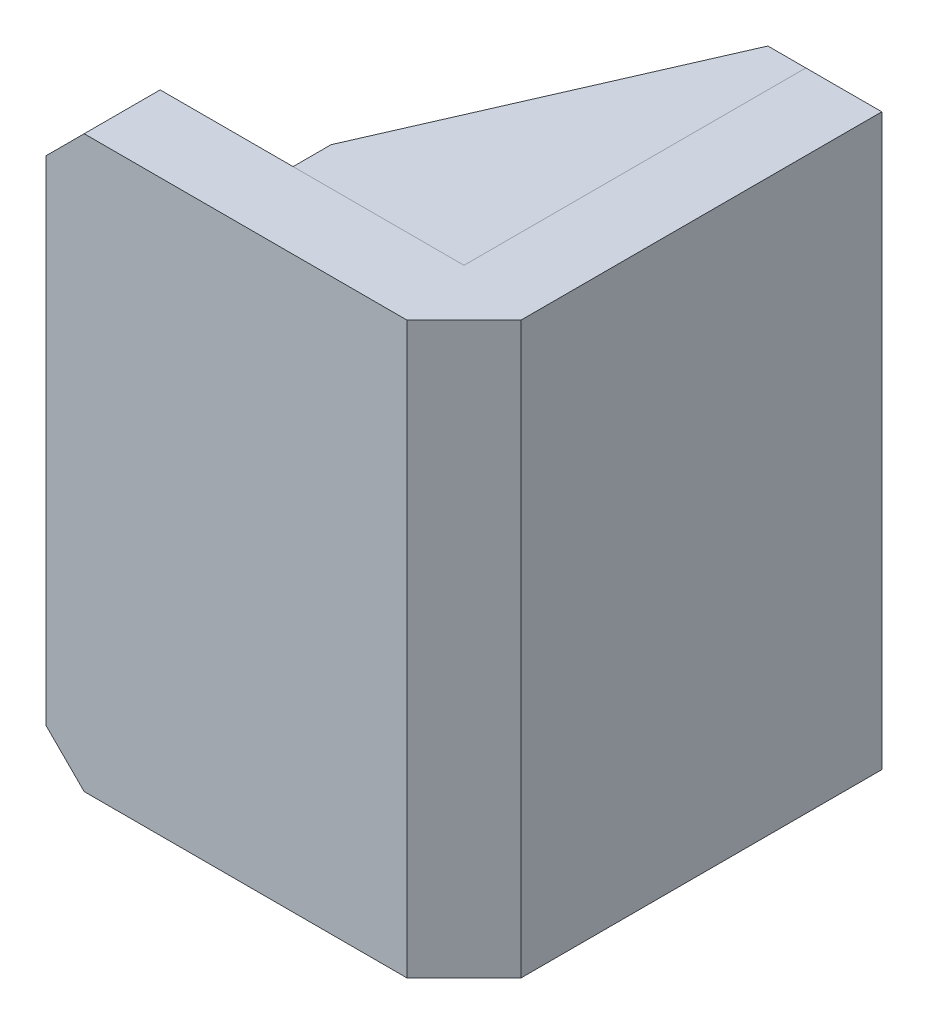
from build123d import *

# Parameters (mm, degrees)
SKETCH_1_W      = 90
SKETCH_1_H      = 150
EXTRUDE_1_DEPTH = 20
SKETCH_2_W      = 110
SKETCH_2_H      = 150
EXTRUDE_2_DEPTH = 20
CHAMFER_1_SIZE  = 10
EXTRUDE_3_DEPTH = 15
CHAMFER_2_SIZE  = 15


with BuildPart() as part:
    # 草图1 → 凸台-拉伸1 (new body)
    with BuildSketch(Plane.XY):
        Rectangle(SKETCH_1_W, SKETCH_1_H)
    extrude(amount=EXTRUDE_1_DEPTH)

    # 草图2 → 凸台-拉伸2 (add)
    with BuildSketch(Plane(origin=(45, 0, 0), x_dir=(0, 0, -1), z_dir=(1, 0, 0))):
        with Locations((35, 0)):
            Rectangle(SKETCH_2_W, SKETCH_2_H)
    extrude(amount=EXTRUDE_2_DEPTH)

    # 倒角1
    chamfer_1_edges = [part.edges().sort_by_distance(p)[0] for p in [
        (-45, -75, 10),
        (-45, 75, 10),
    ]]
    chamfer(chamfer_1_edges, length=CHAMFER_1_SIZE)

    # 倒角2
    chamfer_2_edges = [part.edges().sort_by_distance(p)[0] for p in [
        (65, 0, 20),
    ]]
    chamfer(chamfer_2_edges, length=CHAMFER_2_SIZE)


with BuildPart() as body_2:
    # 草图3 → 凸台-拉伸3 (new body)
    with BuildSketch(Plane(origin=(0, 75, 0), x_dir=(1, 0, 0), z_dir=(0, 1, 0))):
        Polygon((45, 90), (35, 90), (0, 10), (0, 0), (45, 0), align=None)
    extrude(amount=-EXTRUDE_3_DEPTH)


with BuildPart() as body_3:
    # 镜向1: mirrored copy
    add(body_2.part.mirror(Plane.ZX))


solid = Compound([part.part, body_2.part, body_3.part])
